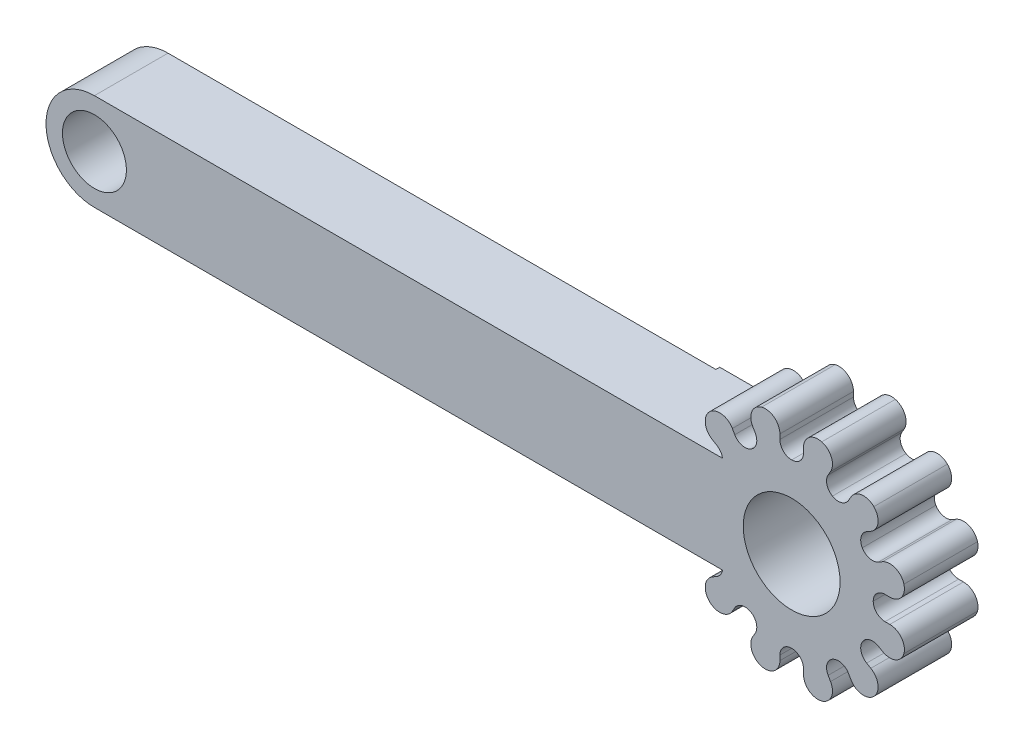
from build123d import *

# Parameters (mm, degrees)
SKETCH1_R           = 1.65
BOSS_EXTRUDE1_DEPTH = 3.8
CUT_EXTRUDE1_DEPTH  = 26.02878343
CIRPATTERN1_COUNT   = 12
SKETCH3_W           = 5.990659071
SKETCH3_H           = 5
BOSS_EXTRUDE2_DEPTH = 4
SKETCH4_R           = 2.5
CUT_EXTRUDE2_DEPTH  = 25.846159393


with BuildPart() as part:
    # Sketch1 → Boss-Extrude1 (new body)
    with BuildSketch(Plane.XY):
        with BuildLine():
            Line((-18, 2.5), (12.545643943, 2.5))
            ThreePointArc((12.545643943, 2.5), (24, 0), (12.545643943, -2.5))
            Line((12.545643943, -2.5), (-18, -2.5))
            ThreePointArc((-18, -2.5), (-20.5, 0), (-18, 2.5))
        make_face()
        with Locations(Location((-18, 0, 0), (0, 0, 180))):
            Circle(SKETCH1_R, mode=Mode.SUBTRACT)
    extrude(amount=BOSS_EXTRUDE1_DEPTH)

    # Sketch2 → Cut-Extrude1 (cut, through all)
    with BuildSketch(Plane.XY.offset(3.8)):
        with BuildLine():
            Line((20.008070513, 4.695554958), (19.882890915, 4.479152397))
            ThreePointArc((19.882890915, 4.479152397), (19.821496871, 4.016588638), (20.105, 3.64596695))
            ThreePointArc((20.105, 3.64596695), (20.567719361, 3.585756883), (20.937614306, 3.870207564))
            Line((20.937614306, 3.870207564), (21.062434622, 4.086817556))
            ThreePointArc((21.062434622, 4.086817556), (21.614093727, 4.455903836), (22.242640687, 4.242640687))
            ThreePointArc((22.242640687, 4.242640687), (21.131352886, 5.423662295), (19.552914271, 5.795554958))
            ThreePointArc((19.552914271, 5.795554958), (20.051879055, 5.357848898), (20.008070513, 4.695554958))
        make_face()
    cut_extrude1 = extrude(amount=-CUT_EXTRUDE1_DEPTH, mode=Mode.SUBTRACT)

    # CirPattern1: Cut-Extrude1 ×12 about axis
    cirpattern1_axis = Axis((18, 0, 0), (0, 0, 1))
    for i in range(1, CIRPATTERN1_COUNT):
        add(cut_extrude1.rotate(cirpattern1_axis, i * 360 / CIRPATTERN1_COUNT), mode=Mode.SUBTRACT)

    # Sketch3 → Boss-Extrude2 (add)
    with BuildSketch(Plane.XY.offset(3.8)):
        with Locations((13.282390893, 0)):
            Rectangle(SKETCH3_W, SKETCH3_H)
    extrude(amount=-BOSS_EXTRUDE2_DEPTH)

    # Sketch4 → Cut-Extrude2 (cut, through all)
    with BuildSketch(Plane.XY.offset(3.8)):
        with Locations((18, 0)):
            Circle(SKETCH4_R)
    extrude(amount=-CUT_EXTRUDE2_DEPTH, mode=Mode.SUBTRACT)


solid = part.part
